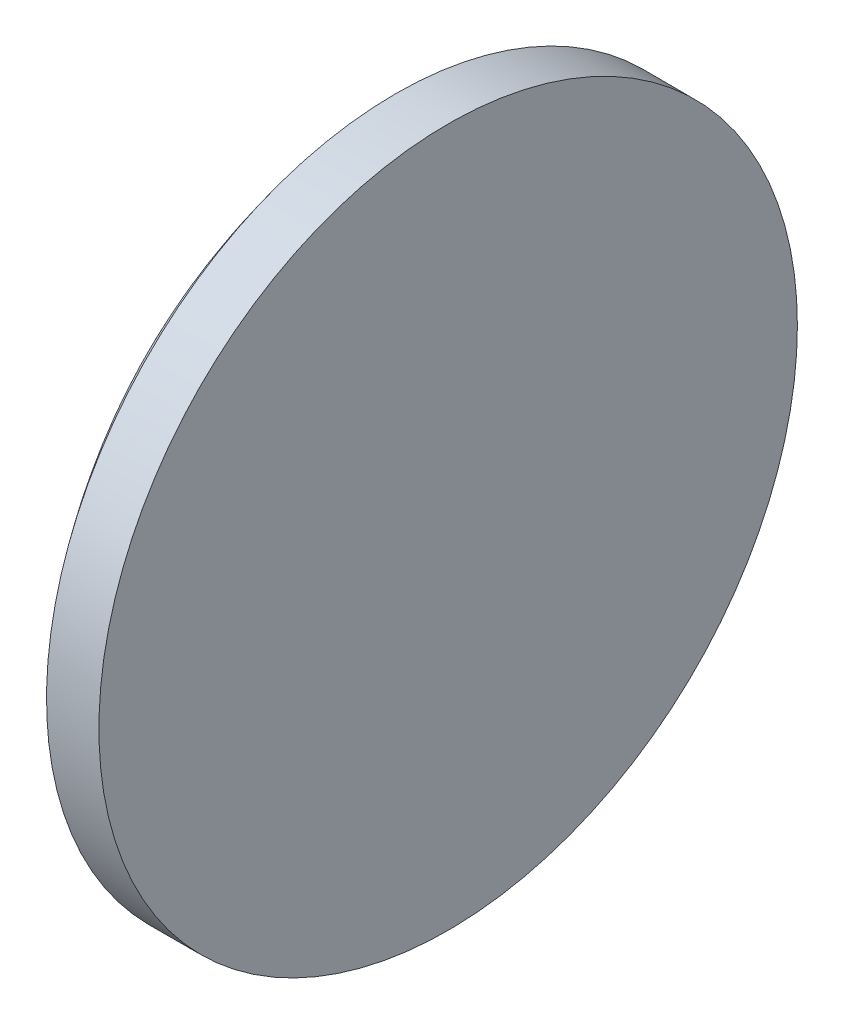
from build123d import *


with BuildPart() as part:
    # Lens Profile → Lens Revolve (revolve)
    with BuildSketch(Plane.XY, mode=Mode.PRIVATE) as lens_revolve_sk:
        with BuildLine():
            Line((0, 2), (-0.3, 2))
            add(Edge.make_bspline(
                [(-0.3, 2), (-0.762879565, 1.406057024), (-1, 0.947696714), (-1, 0)],
                knots=[0, 0, 0, 0, 1, 1, 1, 1], degree=3))
            Line((-1, 0), (0, 0))
            Line((0, 0), (0, 2))
        make_face()
    revolve(lens_revolve_sk.sketch.rotate(Axis((0, 0, 0), (-1, 0, 0)), 90), axis=Axis((0, 0, 0), (-1, 0, 0)))


solid = part.part
